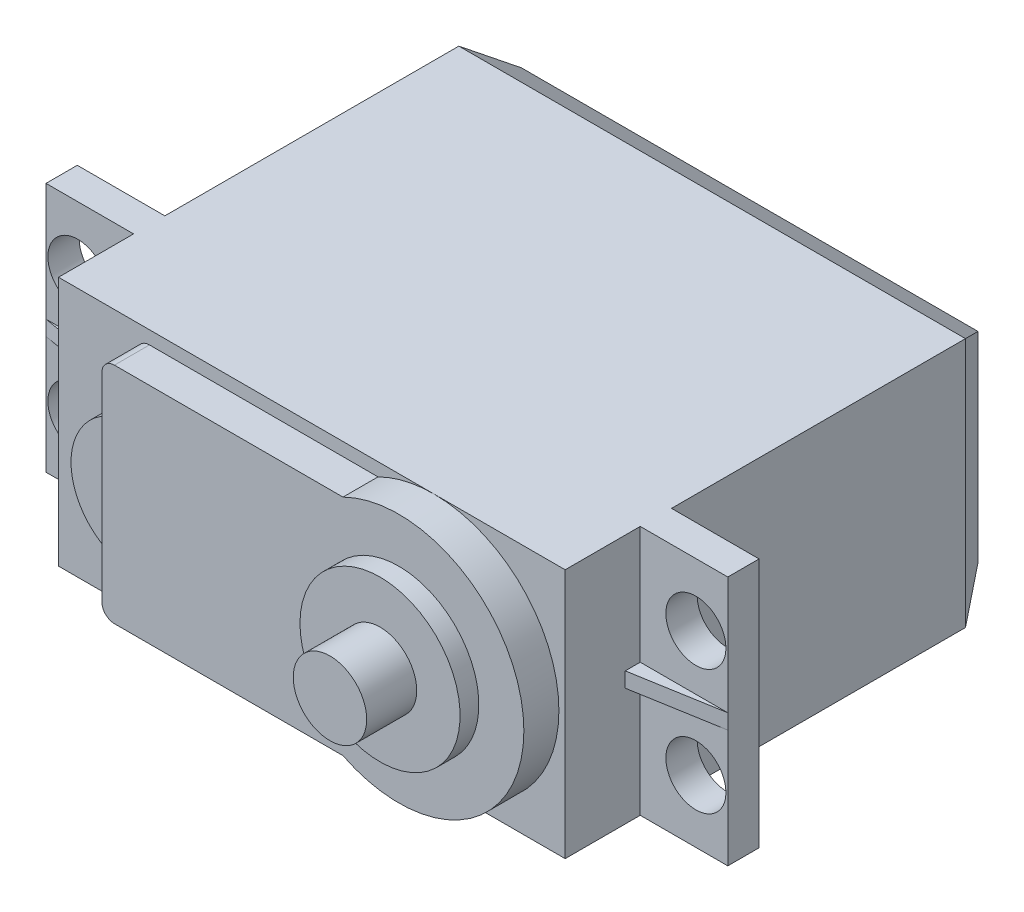
from build123d import *

# Parameters (mm, degrees)
SKETCH1_W                      = 54.5
SKETCH1_H                      = 35
BOSS_EXTRUDE1_DEPTH            = 20
BOSS_EXTRUDE2_DEPTH            = 2.8
SKETCH3_W                      = 7
SKETCH3_H                      = 26.5
CUT_EXTRUDE1_DEPTH             = 47.067911826
SKETCH4_W                      = 7
SKETCH4_H                      = 6
CUT_EXTRUDE2_DEPTH             = 47.067911826
SKETCH5_W                      = 7
SKETCH5_H                      = 6
CUT_EXTRUDE3_DEPTH             = 47.067911826
SKETCH6_W                      = 7
SKETCH6_H                      = 26.5
CUT_EXTRUDE4_DEPTH             = 47.067911826
BOSS_EXTRUDE3_DEPTH            = 2.3
F_4_8_4_8_DIAMETER_HOLE1_D     = 4.8
F_4_8_4_8_DIAMETER_HOLE1_DEPTH = 16.8
RIB1_REACH                     = 48.87
SKETCH11_WALL_W                = 102.842231842
SKETCH11_WALL_H                = 1.2
RIB2_REACH                     = 48.87
SKETCH12_WALL_W                = 102.842231842
SKETCH12_WALL_H                = 1.2
CHAMFER1_SIZE                  = 2
CHAMFER1_SIZE2                 = 3
FILLET1_R                      = 1


with BuildPart() as part:
    # Sketch1 → Boss-Extrude1 (new body)
    with BuildSketch(Plane(origin=(0, 10, 0), x_dir=(1, 0, 0), z_dir=(0, 1, 0))):
        with Locations((0, -11)):
            Rectangle(SKETCH1_W, SKETCH1_H)
    extrude(amount=-BOSS_EXTRUDE1_DEPTH)

    # Sketch2 → Boss-Extrude2 (add)
    with BuildSketch(Plane.XY.offset(28.5)):
        with BuildLine():
            Line((-13.98, 8.95), (5.289338614, 8.95))
            ThreePointArc((5.289338614, 8.95), (19.75, 0), (5.289338614, -8.95))
            Line((5.289338614, -8.95), (-13.98, -8.95))
            Line((-13.98, -8.95), (-13.98, 8.95))
        make_face()
    extrude(amount=BOSS_EXTRUDE2_DEPTH)

    # Sketch3 → Cut-Extrude1 (cut, through all)
    with BuildSketch(Plane.XZ.offset(10)):
        with Locations((-23.75, 6.75)):
            Rectangle(SKETCH3_W, SKETCH3_H)
    extrude(amount=-CUT_EXTRUDE1_DEPTH, mode=Mode.SUBTRACT)

    # Sketch4 → Cut-Extrude2 (cut, through all)
    with BuildSketch(Plane.XZ.offset(10)):
        with Locations((-23.75, 25.5)):
            Rectangle(SKETCH4_W, SKETCH4_H)
    extrude(amount=-CUT_EXTRUDE2_DEPTH, mode=Mode.SUBTRACT)

    # Sketch5 → Cut-Extrude3 (cut, through all)
    with BuildSketch(Plane.XZ.offset(10)):
        with Locations((23.75, 25.5)):
            Rectangle(SKETCH5_W, SKETCH5_H)
    extrude(amount=-CUT_EXTRUDE3_DEPTH, mode=Mode.SUBTRACT)

    # Sketch6 → Cut-Extrude4 (cut, through all)
    with BuildSketch(Plane.XZ.offset(10)):
        with Locations((23.75, 6.75)):
            Rectangle(SKETCH6_W, SKETCH6_H)
    extrude(amount=-CUT_EXTRUDE4_DEPTH, mode=Mode.SUBTRACT)

    # Sketch7 → Boss-Extrude3 (add)
    with BuildSketch(Plane.XY.offset(28.5)):
        with BuildLine():
            Line((-13.98, 4.685), (-13.98, -4.685))
            ThreePointArc((-13.98, -4.685), (-16.95, 0), (-13.98, 4.685))
        make_face()
    extrude(amount=BOSS_EXTRUDE3_DEPTH)

    # Sketch8 → Revolve1 (revolve)
    with BuildSketch(Plane.XZ, mode=Mode.PRIVATE) as revolve1_sk:
        Polygon((12.685, 36.8), (9.75, 36.8), (9.75, 31.3), (16.15, 31.3), (16.15, 32.8), (12.685, 32.8), align=None)
    revolve(revolve1_sk.sketch.rotate(Axis((9.75, 0, 36.8), (0, 0, -1)), 180), axis=Axis((9.75, 0, 36.8), (0, 0, -1)))

    # Ø4.8 (4.8) Diameter Hole1
    with Locations(Plane(origin=(0, 0, 20), x_dir=(-1, 0, 0), z_dir=(0, 0, -1))):
        with Locations((-24.7, -5), (24.7, -5), (24.7, 5), (-24.7, 5)):
            Hole(F_4_8_4_8_DIAMETER_HOLE1_D / 2, depth=F_4_8_4_8_DIAMETER_HOLE1_DEPTH)

    # Sketch11 wall → Rib1 (add, up to next)
    with BuildSketch(Plane(origin=(23.75, 0, 23.1), x_dir=(0.985622254813, 0, -0.168963815111), z_dir=(-0.168963815111, 0, -0.985622254813)), mode=Mode.PRIVATE) as rib1_sk1:
        Rectangle(SKETCH11_WALL_W, SKETCH11_WALL_H)
    rib1_tool1 = extrude(rib1_sk1.sketch, amount=RIB1_REACH, mode=Mode.PRIVATE) - part.part
    add(rib1_tool1.solids().sort_by_distance((23.75, 0, 23.1))[0])

    # Sketch12 wall → Rib2 (add, up to next)
    with BuildSketch(Plane(origin=(-23.75, 0, 23.1), x_dir=(0.985622254813, 0, 0.168963815111), z_dir=(0.168963815111, 0, -0.985622254813)), mode=Mode.PRIVATE) as rib2_sk1:
        Rectangle(SKETCH12_WALL_W, SKETCH12_WALL_H)
    rib2_tool1 = extrude(rib2_sk1.sketch, amount=RIB2_REACH, mode=Mode.PRIVATE) - part.part
    add(rib2_tool1.solids().sort_by_distance((-23.75, 0, 23.1))[0])

    # Chamfer1
    chamfer1_edges = [part.edges().sort_by_distance(p)[0] for p in [
        (-20.25, 0, -6.5),
        (0, 10, -6.5),
        (0, -10, -6.5),
        (20.25, 0, -6.5),
    ]]
    chamfer1_side = [part.faces().sort_by_distance(p)[0] for p in [
        (0, 0, -6.5),
    ]]
    chamfer(chamfer1_edges, length=CHAMFER1_SIZE, length2=CHAMFER1_SIZE2, reference=chamfer1_side[0])

    # Fillet1
    fillet1_edges = [part.edges().sort_by_distance(p)[0] for p in [
        (-13.98, 8.95, 29.9),
        (-13.98, -8.95, 29.9),
    ]]
    fillet(fillet1_edges, radius=FILLET1_R)


solid = part.part
